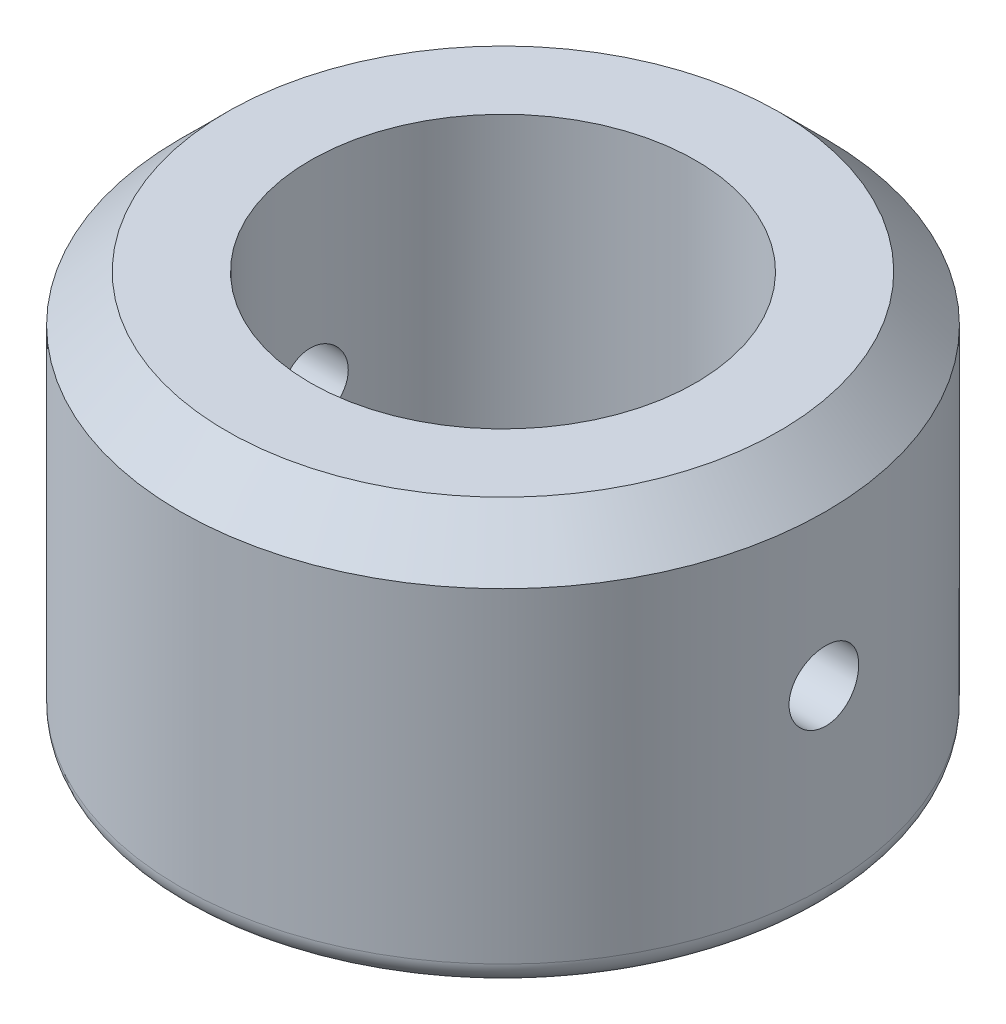
from build123d import *

# Parameters (mm, degrees)
SKETCH1_W               = 2.8
SKETCH1_H               = 8.5
CHAMFER1_SIZE           = 1
CUT_EXTRUDE1_DEPTH      = 11.70829118
CUT_EXTRUDE1_DEPTH_BACK = 11.70829118
SKETCH3_R               = 0.75
FILLET1_R               = 0.5


with BuildPart() as part:
    # Sketch1 → Revolve1 (revolve)
    with BuildSketch(Plane(origin=(0, 0, 0), x_dir=(0, 0, -1), z_dir=(1, 0, 0)), mode=Mode.PRIVATE) as revolve1_sk:
        with Locations((5.55, 0)):
            Rectangle(SKETCH1_W, SKETCH1_H)
    revolve(revolve1_sk.sketch.rotate(Axis((0, 19.013157895, 0), (0, -1, 0)), 180), axis=Axis((0, 19.013157895, 0), (0, -1, 0)))

    # Chamfer1
    chamfer1_edges = [part.edges().sort_by_distance(p)[0] for p in [
        (0, 4.25, -6.95),
    ]]
    chamfer(chamfer1_edges, length=CHAMFER1_SIZE)

    # Sketch3 → Cut-Extrude1 (cut, two sides: drawn at the far end of the back side and taken through both)
    with BuildSketch(Plane(origin=(0, 0, 0), x_dir=(0, 0, -1), z_dir=(1, 0, 0)).offset(-CUT_EXTRUDE1_DEPTH_BACK)):
        Circle(SKETCH3_R)
    extrude(amount=CUT_EXTRUDE1_DEPTH + CUT_EXTRUDE1_DEPTH_BACK, mode=Mode.SUBTRACT)

    # Fillet1
    fillet1_edges = [part.edges().sort_by_distance(p)[0] for p in [
        (0, -4.25, -6.95),
    ]]
    fillet(fillet1_edges, radius=FILLET1_R)


solid = part.part
